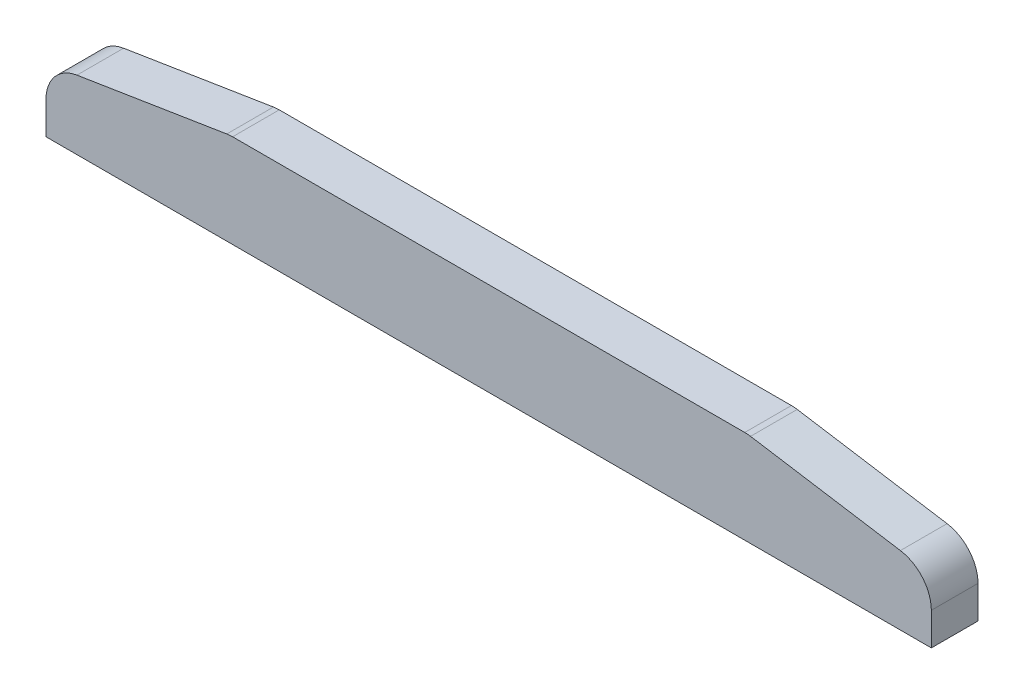
from build123d import *
from OCP.BRepFilletAPI import BRepFilletAPI_MakeChamfer

# Parameters (mm, degrees)
SKETCH1_W                 = 241
SKETCH1_H                 = 12.7
BOSS_EXTRUDE1_DEPTH       = 25.4
CHAMFER1_SIZE             = 8
CHAMFER1_SIZE2            = 50
M5X0_8_TAPPED_HOLE1_D     = 4.2
M5X0_8_TAPPED_HOLE1_DEPTH = 12
M5X0_8_TAPPED_HOLE1_TIP   = 1.2618073
FILLET1_R                 = 10


with BuildPart() as part:
    # Sketch1 → Boss-Extrude1 (new body)
    with BuildSketch(Plane(origin=(0, 0, 0), x_dir=(1, 0, 0), z_dir=(0, 1, 0))):
        Rectangle(SKETCH1_W, SKETCH1_H)
    extrude(amount=BOSS_EXTRUDE1_DEPTH)

    # Chamfer1: one chamfer whose edges measure the first distance from different faces: ONE call of the kernel's chamfer builder (chamfer() names one face for all edges)
    chamfer1_edges_1 = [part.edges().sort_by_distance(p)[0] for p in [
        (-120.5, 25.4, 0),
    ]]
    chamfer1_side_1 = [part.faces().sort_by_distance(p)[0] for p in [
        (-120.5, 12.7, 0),
    ]]
    chamfer1_edges_2 = [part.edges().sort_by_distance(p)[0] for p in [
        (120.5, 25.4, 0),
    ]]
    chamfer1_side_2 = [part.faces().sort_by_distance(p)[0] for p in [
        (120.5, 12.7, 0),
    ]]
    chamfer1 = BRepFilletAPI_MakeChamfer(part.part.solid().wrapped)
    for e in chamfer1_edges_1:
        chamfer1.Add(CHAMFER1_SIZE, CHAMFER1_SIZE2, e.wrapped, chamfer1_side_1[0].wrapped)  # the first distance lies on this face
    for e in chamfer1_edges_2:
        chamfer1.Add(CHAMFER1_SIZE, CHAMFER1_SIZE2, e.wrapped, chamfer1_side_2[0].wrapped)  # the first distance lies on this face
    add(Compound.cast(chamfer1.Shape()), mode=Mode.REPLACE)

    # M5x0.8 Tapped Hole1
    with Locations(Plane(origin=(0, 0, 0), x_dir=(-1, 0, 0), z_dir=(0, -1, 0))):
        with Locations((112.5, 0), (67.5, 0), (22.5, 0), (-22.5, 0), (-67.5, 0), (-112.5, 0)):
            Hole(M5X0_8_TAPPED_HOLE1_D / 2, depth=M5X0_8_TAPPED_HOLE1_DEPTH)
            with Locations((0, 0, -(M5X0_8_TAPPED_HOLE1_DEPTH + M5X0_8_TAPPED_HOLE1_TIP / 2))):  # 118° drill point
                Cone(0, M5X0_8_TAPPED_HOLE1_D / 2, M5X0_8_TAPPED_HOLE1_TIP, mode=Mode.SUBTRACT)

    # Fillet1
    fillet1_edges = [part.edges().sort_by_distance(p)[0] for p in [
        (-70.5, 25.4, 0),
        (70.5, 25.4, 0),
        (120.5, 17.4, 0),
        (-120.5, 17.4, 0),
    ]]
    fillet(fillet1_edges, radius=FILLET1_R)


solid = part.part
